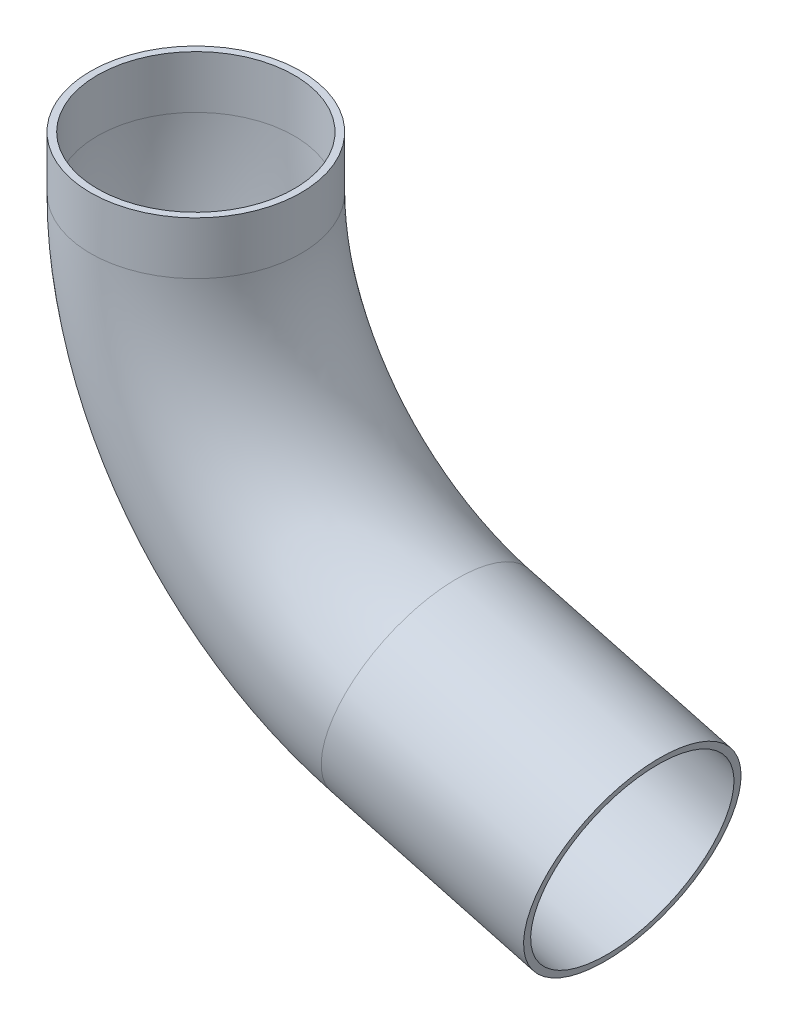
from build123d import *

# Parameters (mm, degrees)
SKETCH2_R   = 25.4
SKETCH2_R_2 = 23.749


with BuildPart() as part:
    # Sweep1: sweep along a path in Sketch1
    with BuildLine(Plane.XY) as sweep1_path:
        Line((0, 0), (0, -12.7))
        ThreePointArc((0, -12.7), (15.74647547, -59.08762089), (56.477988763, -86.303547963))
        Line((56.477988763, -86.303547963), (105.301675579, -99.385815417))
    # Sketch2 → Sweep1 (sweep)
    with BuildSketch(Plane(origin=(0, 0, 0), x_dir=(1, 0, 0), z_dir=(0, 1, 0))):
        Circle(SKETCH2_R)
        Circle(SKETCH2_R_2, mode=Mode.SUBTRACT)
    sweep(path=sweep1_path.line)


solid = part.part
